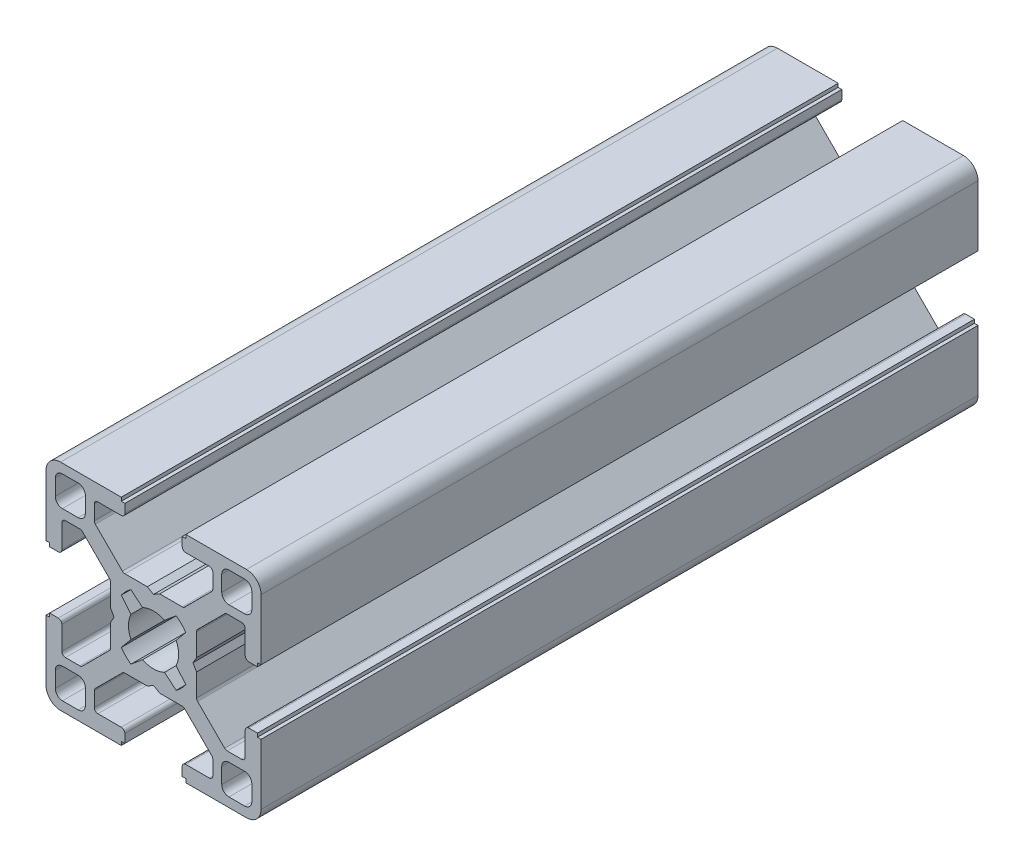
from build123d import *

# Parameters (mm, degrees)
BOSS_EXTRUDE1_DEPTH = 50
CIRPATTERN1_COUNT   = 4


with BuildPart() as part:
    # Sketch3 → Boss-Extrude1 (new, symmetric)
    with BuildSketch(Plane.XY):
        with BuildLine():
            Line((-4.503841895, 3.156803476), (-3.14772708, 1.530298739))
            ThreePointArc((-3.14772708, 1.530298739), (-3.410794979, 0.785160882), (-3.5, 0))
            Line((-3.5, 0), (-5.5, 0))
            Line((-5.5, 0), (-6, 0.866025404))
            Line((-6, 0.866025404), (-6, 3.996841995))
            ThreePointArc((-6, 3.996841995), (-6.038060234, 4.188183711), (-6.146446609, 4.350395385))
            Line((-6.146446609, 4.350395385), (-9.917104615, 8.121053391))
            ThreePointArc((-9.917104615, 8.121053391), (-10.079316289, 8.229439766), (-10.270658005, 8.2675))
            Line((-10.270658005, 8.2675), (-12.29, 8.2675))
            ThreePointArc((-12.29, 8.2675), (-12.643553391, 8.121053391), (-12.79, 7.7675))
            Line((-12.79, 7.7675), (-12.79, 4.5))
            ThreePointArc((-12.79, 4.5), (-12.936446609, 4.146446609), (-13.29, 4))
            Line((-13.29, 4), (-14.5, 4))
            Line((-14.5, 4), (-14.5, 4.5))
            Line((-14.5, 4.5), (-15, 4.5))
            Line((-15, 4.5), (-15, 12.968))
            ThreePointArc((-15, 12.968), (-14.404840979, 14.404840979), (-12.968, 15))
            Line((-12.968, 15), (-4.5, 15))
            Line((-4.5, 15), (-4.5, 14.5))
            Line((-4.5, 14.5), (-4, 14.5))
            Line((-4, 14.5), (-4, 13.29))
            ThreePointArc((-4, 13.29), (-4.146446609, 12.936446609), (-4.5, 12.79))
            Line((-4.5, 12.79), (-7.7675, 12.79))
            ThreePointArc((-7.7675, 12.79), (-8.121053391, 12.643553391), (-8.2675, 12.29))
            Line((-8.2675, 12.29), (-8.2675, 10.270658005))
            ThreePointArc((-8.2675, 10.270658005), (-8.229439766, 10.079316289), (-8.121053391, 9.917104615))
            Line((-8.121053391, 9.917104615), (-4.350395385, 6.146446609))
            ThreePointArc((-4.350395385, 6.146446609), (-4.188183711, 6.038060234), (-3.996841995, 6))
            Line((-3.996841995, 6), (-0.866025404, 6))
            Line((-0.866025404, 6), (0, 5.5))
            Line((0, 5.5), (0, 3.5))
            ThreePointArc((0, 3.5), (-0.785160882, 3.410794979), (-1.530298739, 3.14772708))
            Line((-1.530298739, 3.14772708), (-3.156803476, 4.503841895))
            ThreePointArc((-3.156803476, 4.503841895), (-3.889087297, 3.889087297), (-4.503841895, 3.156803476))
        make_face()
        with BuildLine():
            Line((-12.705, 9.5135), (-10.5135, 9.5135))
            ThreePointArc((-10.5135, 9.5135), (-9.806393219, 9.806393219), (-9.5135, 10.5135))
            Line((-9.5135, 10.5135), (-9.5135, 12.705))
            ThreePointArc((-9.5135, 12.705), (-9.806393219, 13.412106781), (-10.5135, 13.705))
            Line((-10.5135, 13.705), (-12.705, 13.705))
            ThreePointArc((-12.705, 13.705), (-13.412106781, 13.412106781), (-13.705, 12.705))
            Line((-13.705, 12.705), (-13.705, 10.5135))
            ThreePointArc((-13.705, 10.5135), (-13.412106781, 9.806393219), (-12.705, 9.5135))
        make_face(mode=Mode.SUBTRACT)
    boss_extrude1 = extrude(amount=BOSS_EXTRUDE1_DEPTH, both=True)

    # CirPattern1: Boss-Extrude1 ×4 about axis
    cirpattern1_axis = Axis((0, 0, 0), (0, 0, 1))
    for i in range(1, CIRPATTERN1_COUNT):
        add(boss_extrude1.rotate(cirpattern1_axis, i * 360 / CIRPATTERN1_COUNT))


solid = part.part
